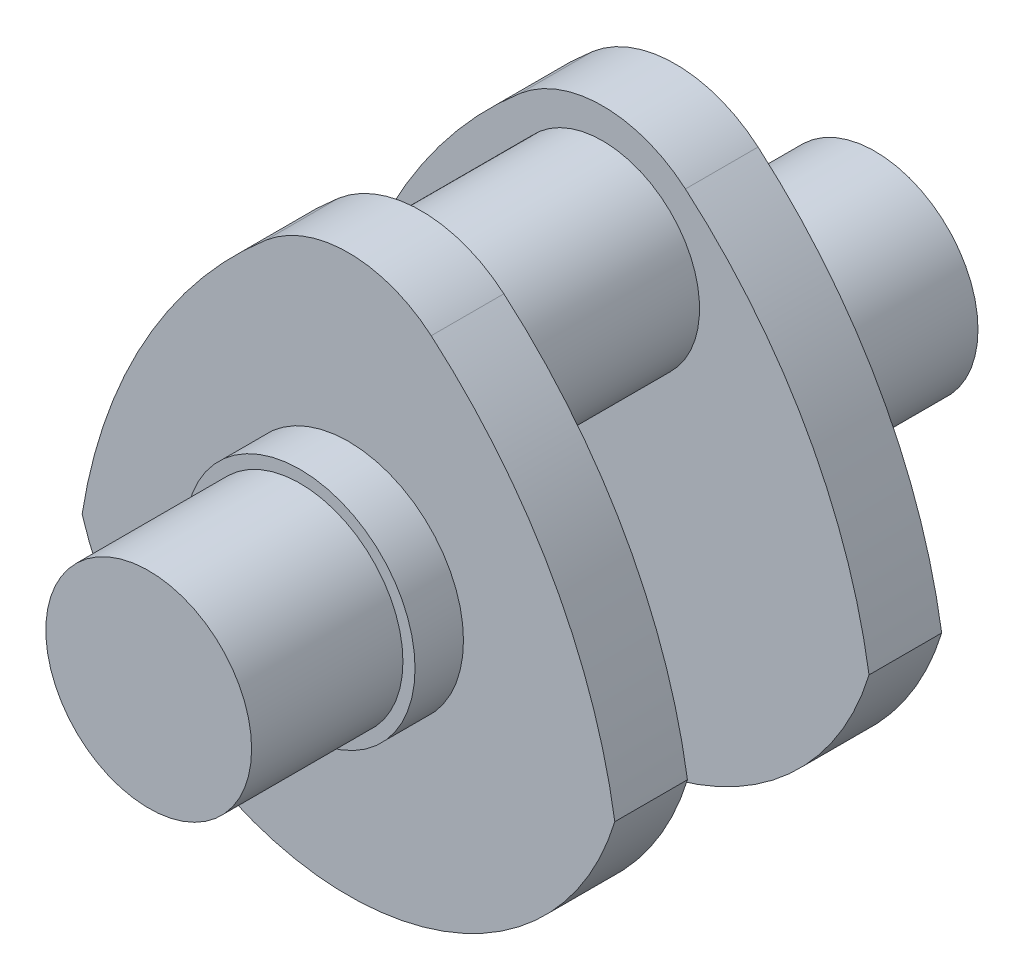
from build123d import *

# Parameters (mm, degrees)
SKETCH2_R           = 17
BOSS_EXTRUDE1_DEPTH = 25
SKETCH3_R           = 19
BOSS_EXTRUDE2_DEPTH = 8
BOSS_EXTRUDE3_DEPTH = 12
SKETCH5_R           = 16
BOSS_EXTRUDE4_DEPTH = 15


with BuildPart() as part:
    # Sketch2 → Boss-Extrude1 (new body)
    with BuildSketch(Plane.XY):
        Circle(SKETCH2_R)
    extrude(amount=BOSS_EXTRUDE1_DEPTH)

    # Sketch3 → Boss-Extrude2 (add)
    with BuildSketch(Plane.XY):
        Circle(SKETCH3_R)
    extrude(amount=-BOSS_EXTRUDE2_DEPTH)

    # Sketch4 → Boss-Extrude3 (add)
    with BuildSketch(Plane(origin=(0, 0, -8), x_dir=(-1, 0, 0), z_dir=(0, 0, -1))):
        with BuildLine():
            ThreePointArc((-44, -13.416407865), (0, -46), (44, -13.416407865))
            ThreePointArc((44, -13.416407865), (33.683444249, 16.469257624), (13.668094758, 40.943123461))
            ThreePointArc((13.668094758, 40.943123461), (0, 46), (-13.668094758, 40.943123461))
            ThreePointArc((-13.668094758, 40.943123461), (-33.683444249, 16.469257624), (-44, -13.416407865))
        make_face()
    extrude(amount=BOSS_EXTRUDE3_DEPTH)

    # Sketch5 → Boss-Extrude4 (add)
    with BuildSketch(Plane(origin=(0, 0, -20), x_dir=(-1, 0, 0), z_dir=(0, 0, -1))):
        with Locations((0, 25)):
            Circle(SKETCH5_R)
    extrude(amount=BOSS_EXTRUDE4_DEPTH)

    # Mirror1: part across plane


with BuildPart() as part_1:
    add(part.part)
    add(part.part.mirror(Plane(origin=(0, 25, -35), x_dir=(1, 0, 0), z_dir=(0, 0, -1))))


solid = part_1.part
